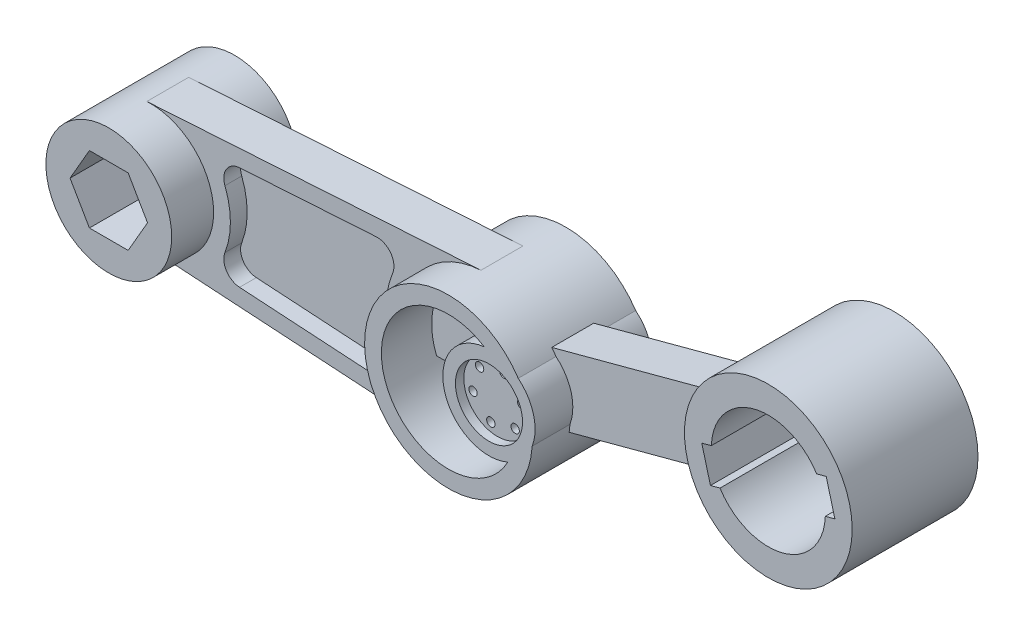
from build123d import *
from build123d.topology import SkipClean

# Parameters (mm, degrees)
LEFT_ARM_DEPTH                = 12.5
SKETCH2_R                     = 37.5
LEFT_BOSS_DEPTH               = 37.5
LEFT_HEX_DEPTH                = 266.753645
LEFT_HEX_DEPTH_BACK           = 266.753645
SKETCH3_R                     = 50
CENTRE_BOSS_DEPTH             = 35
SKETCH5_W                     = 25
SKETCH5_H                     = 40
RIGHT_ARM_DEPTH               = 200
SKETCH7_R                     = 50
RIGHT_BOSS_DEPTH              = 37.5
SKETCH8_R                     = 34
RIGHT_BOSS_HOLE_DEPTH         = 461.862196
SKETCH9_R                     = 40
CENTRE_HOLE_DEPTH             = 461.461957
SKETCH10_R                    = 27.5
CENTRE_BLOB_DEPTH             = 35
CENTRE_BEAM_REACH             = 268.273
SKETCH11_W                    = 10
SKETCH11_H                    = 30
CENTRE_BEAM_DIRECTION_2_REACH = 268.273
SKETCH12_R                    = 20
CUT_EXTRUDE4_DEPTH            = 5
M6X1_0_TAPPED_HOLE1_D         = 5
CIRPATTERN1_COUNT             = 6
CUT_OUT_DEPTH                 = 10
FILLET1_R                     = 10
FILLET1_OF_MIRROR2_R          = 10
KEYWAY_DEPTH                  = 457.26222


with BuildPart() as part:
    # Sketch1 → LEFT_ARM (new, symmetric)
    with BuildSketch(Plane.XY):
        with BuildLine():
            Line((-2.34375, 37.426686), (196.875, 49.902248))
            ThreePointArc((196.875, 49.902248), (250, 0), (196.875, -49.902248))
            Line((196.875, -49.902248), (-2.34375, -37.426686))
            ThreePointArc((-2.34375, -37.426686), (-37.5, 0), (-2.34375, 37.426686))
        make_face()
    extrude(amount=LEFT_ARM_DEPTH, both=True)

    # Sketch2 → LEFT_Boss (add, symmetric)
    with SkipClean():  # the faces are left unmerged after this step: merging them gives an invalid solid
        with BuildSketch(Plane.XY):
            Circle(SKETCH2_R)
        extrude(amount=LEFT_BOSS_DEPTH, both=True)

    # Sketch4 → LEFT_Hex (cut, two sides: drawn at the far end of the back side and taken through both)
    with SkipClean():  # the faces are left unmerged after this step: merging them gives an invalid solid
        with BuildSketch(Plane.XY.offset(37.5).offset(-LEFT_HEX_DEPTH_BACK)):
            Polygon((23.094011, 0), (11.547005, 20), (-11.547005, 20), (-23.094011, 0), (-11.547005, -20), (11.547005, -20), align=None)
        extrude(amount=LEFT_HEX_DEPTH + LEFT_HEX_DEPTH_BACK, mode=Mode.SUBTRACT)

    # Sketch3 → CENTRE_Boss (add, symmetric)
    with SkipClean():  # the faces are left unmerged after this step: merging them gives an invalid solid
        with BuildSketch(Plane.XY):
            with Locations((200, 0)):
                Circle(SKETCH3_R)
        extrude(amount=CENTRE_BOSS_DEPTH, both=True)

    # Sketch5 → RIGHT_ARM (add)
    with SkipClean():  # the faces are left unmerged after this step: merging them gives an invalid solid
        with BuildSketch(Plane(origin=(186.60254, 50, 0), x_dir=(0, 0, -1), z_dir=(0.9659258262890681, 0.25881904510252135, 0))):
            with Locations((0, -51.763809)):
                Rectangle(SKETCH5_W, SKETCH5_H)
        extrude(amount=RIGHT_ARM_DEPTH)

    # Sketch7 → RIGHT_Boss (add, symmetric)
    with SkipClean():  # the faces are left unmerged after this step: merging them gives an invalid solid
        with BuildSketch(Plane.XY):
            with Locations((393.185165, 51.763809)):
                Circle(SKETCH7_R)
        extrude(amount=RIGHT_BOSS_DEPTH, both=True)

    # Sketch8 → RIGHT_Boss_Hole (cut, through all)
    with SkipClean():  # the faces are left unmerged after this step: merging them gives an invalid solid
        with BuildSketch(Plane.XY.offset(37.5)):
            with Locations((393.185165, 51.763809)):
                Circle(SKETCH8_R)
        extrude(amount=-RIGHT_BOSS_HOLE_DEPTH, mode=Mode.SUBTRACT)

    # Sketch9 → CENTRE_Hole (cut, through all)
    with SkipClean():  # the faces are left unmerged after this step: merging them gives an invalid solid
        with BuildSketch(Plane.XY.offset(35)):
            with Locations((200, 0)):
                Circle(SKETCH9_R)
        extrude(amount=-CENTRE_HOLE_DEPTH, mode=Mode.SUBTRACT)

    # Sketch10 → CENTRE_Blob (add, symmetric)
    with SkipClean():  # the faces are left unmerged after this step: merging them gives an invalid solid
        with BuildSketch(Plane.XY):
            with Locations((224.148146, 6.470476)):
                Circle(SKETCH10_R)
        extrude(amount=CENTRE_BLOB_DEPTH, both=True)

    # Sketch11 → CENTRE_Beam (add, up to next)
    with BuildSketch(Plane(origin=(200, 0, 0), x_dir=(0, 0, -1), z_dir=(1, 0, 0)), mode=Mode.PRIVATE) as centre_beam_sk1:
        Rectangle(SKETCH11_W, SKETCH11_H)
    centre_beam_tool1 = extrude(centre_beam_sk1.sketch, amount=CENTRE_BEAM_REACH, mode=Mode.PRIVATE) - part.part
    add(centre_beam_tool1.solids().sort_by_distance((200, 0, 0))[0])

    # Sketch11 → CENTRE_Beam direction 2 (add, up to next)
    with BuildSketch(Plane(origin=(200, 0, 0), x_dir=(0, 0, -1), z_dir=(1, 0, 0)), mode=Mode.PRIVATE) as centre_beam_direction_2_sk1:
        Rectangle(SKETCH11_W, SKETCH11_H)
    centre_beam_direction_2_tool1 = extrude(centre_beam_direction_2_sk1.sketch, amount=-CENTRE_BEAM_DIRECTION_2_REACH, mode=Mode.PRIVATE) - part.part
    add(centre_beam_direction_2_tool1.solids().sort_by_distance((200, 0, 0))[0])

    # Sketch12 → Cut-Extrude4 (cut)
    with SkipClean():  # the faces are left unmerged after this step: merging them gives an invalid solid
        with BuildSketch(Plane.XY.offset(35)):
            with Locations((224.148146, 6.470476)):
                Circle(SKETCH12_R)
        cut_extrude4 = extrude(amount=-CUT_EXTRUDE4_DEPTH, mode=Mode.SUBTRACT)

    # M6x1.0 Tapped Hole1 (through all)
    with Locations(Plane.XY.offset(30)):
        with Locations((209.659258, 2.58819)):
            m6x1_0_tapped_hole1 = Hole(M6X1_0_TAPPED_HOLE1_D / 2)

    # CirPattern1: M6x1.0 Tapped Hole1 ×6 about axis
    with SkipClean():  # the faces are left unmerged after this step: merging them gives an invalid solid
        cirpattern1_axis = Axis((224.148146, 6.470476, 0), (0, 0, 1))
        for i in range(1, CIRPATTERN1_COUNT):
            add(m6x1_0_tapped_hole1.rotate(cirpattern1_axis, i * 360 / CIRPATTERN1_COUNT), mode=Mode.SUBTRACT)

    # Mirror1: Cut-Extrude4 across plane
    with SkipClean():  # the faces are left unmerged after this step: merging them gives an invalid solid
        add(cut_extrude4.mirror(Plane.XY), mode=Mode.SUBTRACT)

    # Sketch15 → Cut_OUT (cut)
    with SkipClean():  # the faces are left unmerged after this step: merging them gives an invalid solid
        with BuildSketch(Plane.XY.offset(12.5)):
            with BuildLine():
                Line((152.866072, 37.126714), (36.935365, 29.866851))
                ThreePointArc((36.935365, 29.866851), (47.5, 0), (36.935365, -29.866851))
                Line((36.935365, -29.866851), (152.866072, -37.126714))
                ThreePointArc((152.866072, -37.126714), (140, 0), (152.866072, 37.126714))
            make_face()
        cut_out = extrude(amount=-CUT_OUT_DEPTH, mode=Mode.SUBTRACT)

    # Fillet1
    fillet1_edges = [part.edges().sort_by_distance(p)[0] for p in [
        (36.935365, -29.866851, 7.5),
        (36.935365, 29.866851, 7.5),
        (152.866072, 37.126714, 7.5),
        (152.866072, -37.126714, 7.5),
    ]]
    fillet(fillet1_edges, radius=FILLET1_R)

    # Mirror2: Cut_OUT across plane
    with SkipClean():  # the faces are left unmerged after this step: merging them gives an invalid solid
        add(cut_out.mirror(Plane.XY), mode=Mode.SUBTRACT)

    # Fillet1 of Mirror2
    fillet1_of_mirror2_edges = [part.edges().sort_by_distance(p)[0] for p in [
        (36.935365, -29.866851, -7.5),
        (36.935365, 29.866851, -7.5),
        (152.866072, 37.126714, -7.5),
        (152.866072, -37.126714, -7.5),
    ]]
    fillet(fillet1_of_mirror2_edges, radius=FILLET1_OF_MIRROR2_R)

    # Sketch16 → KEYWAY (cut, symmetric)
    with SkipClean():  # the faces are left unmerged after this step: merging them gives an invalid solid
        with BuildSketch(Plane.XY):
            Polygon((395.773356, 42.104551), (390.596975, 61.423067), (353.505423, 51.484416), (358.681804, 32.165899), align=None)
        keyway = extrude(amount=KEYWAY_DEPTH, both=True, mode=Mode.SUBTRACT)

    # Mirror3: KEYWAY across plane
    with SkipClean():  # the faces are left unmerged after this step: merging them gives an invalid solid
        add(keyway.mirror(Plane(origin=(379.787706, 101.763809, 0), x_dir=(0, 0, 1), z_dir=(0.9659258262890681, 0.25881904510252135, 0))), mode=Mode.SUBTRACT)


solid = part.part
